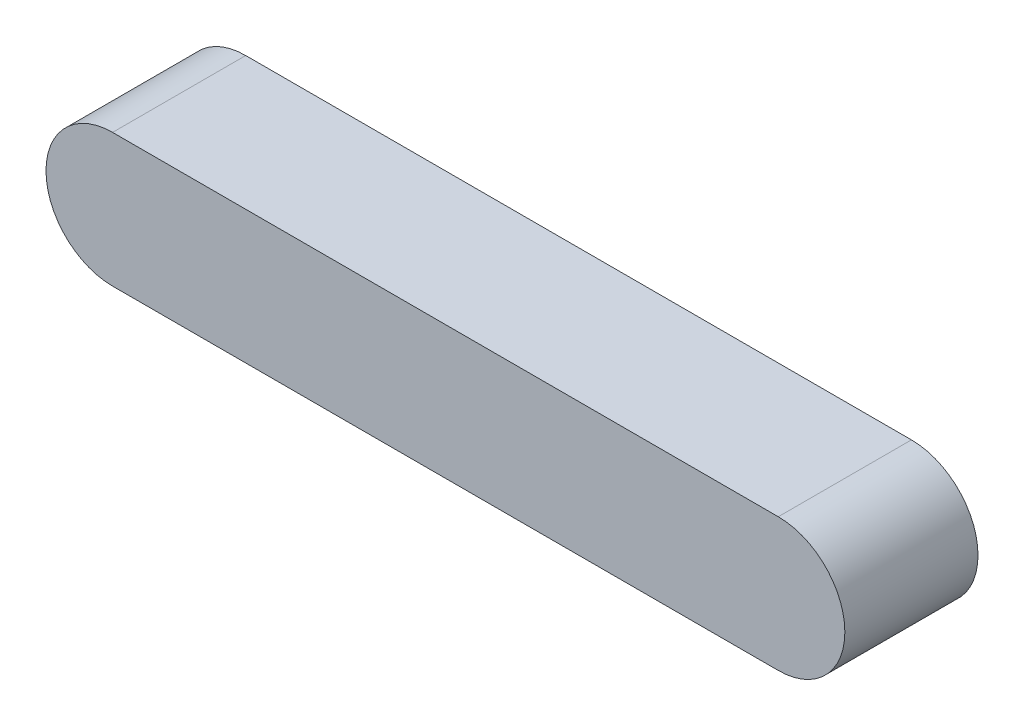
from build123d import *

# Parameters (mm, degrees)
EXTRUSION1_DEPTH = 2


with BuildPart() as part:
    # Esquisse1 → Extrusion1 (new body)
    with BuildSketch(Plane.XY):
        with BuildLine():
            Line((0, 0), (10, 0))
            ThreePointArc((10, 0), (11, -1), (10, -2))
            Line((10, -2), (0, -2))
            ThreePointArc((0, -2), (-1, -1), (0, 0))
        make_face()
    extrude(amount=EXTRUSION1_DEPTH)


solid = part.part
